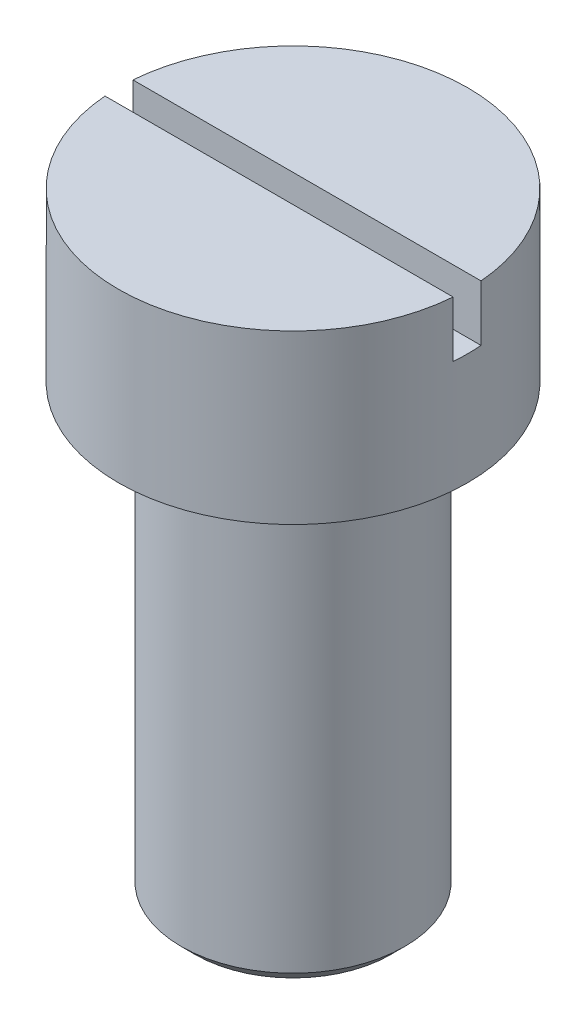
from build123d import *

# Parameters (mm, degrees)
SKETCH1_R               = 12.5
BOSS_EXTRUDE1_DEPTH     = 12
SKETCH2_R               = 8
BOSS_EXTRUDE2_DEPTH     = 32
CUT_EXTRUDE1_DEPTH      = 37.558172821
CUT_EXTRUDE1_DEPTH_BACK = 37.558172821
CHAMFER1_SIZE           = 1


with BuildPart() as part:
    # Sketch1 → Boss-Extrude1 (new body)
    with BuildSketch(Plane(origin=(0, 0, 0), x_dir=(1, 0, 0), z_dir=(0, 1, 0))):
        with Locations(Location((0, 0, 0), (0, 0, 270))):
            Circle(SKETCH1_R)
    extrude(amount=BOSS_EXTRUDE1_DEPTH)

    # Sketch2 → Boss-Extrude2 (add)
    with BuildSketch(Plane.XZ):
        with Locations(Location((0, 0, 0), (0, 0, 270))):
            Circle(SKETCH2_R)
    extrude(amount=BOSS_EXTRUDE2_DEPTH)

    # Sketch3 → Cut-Extrude1 (cut, two sides: drawn at the far end of the back side and taken through both)
    with BuildSketch(Plane(origin=(0, 0, 0), x_dir=(0, 0, -1), z_dir=(1, 0, 0)).offset(-CUT_EXTRUDE1_DEPTH_BACK)):
        Polygon((-1, 114.048900048), (-1, 12), (-1, 8), (1, 8), (1, 12), (1, 114.048900048), (1, 318.146700143), (-1, 318.146700143), align=None)
    extrude(amount=CUT_EXTRUDE1_DEPTH + CUT_EXTRUDE1_DEPTH_BACK, mode=Mode.SUBTRACT)

    # Chamfer1
    chamfer1_edges = [part.edges().sort_by_distance(p)[0] for p in [
        (0, -32, 8),
    ]]
    chamfer(chamfer1_edges, length=CHAMFER1_SIZE)


solid = part.part
